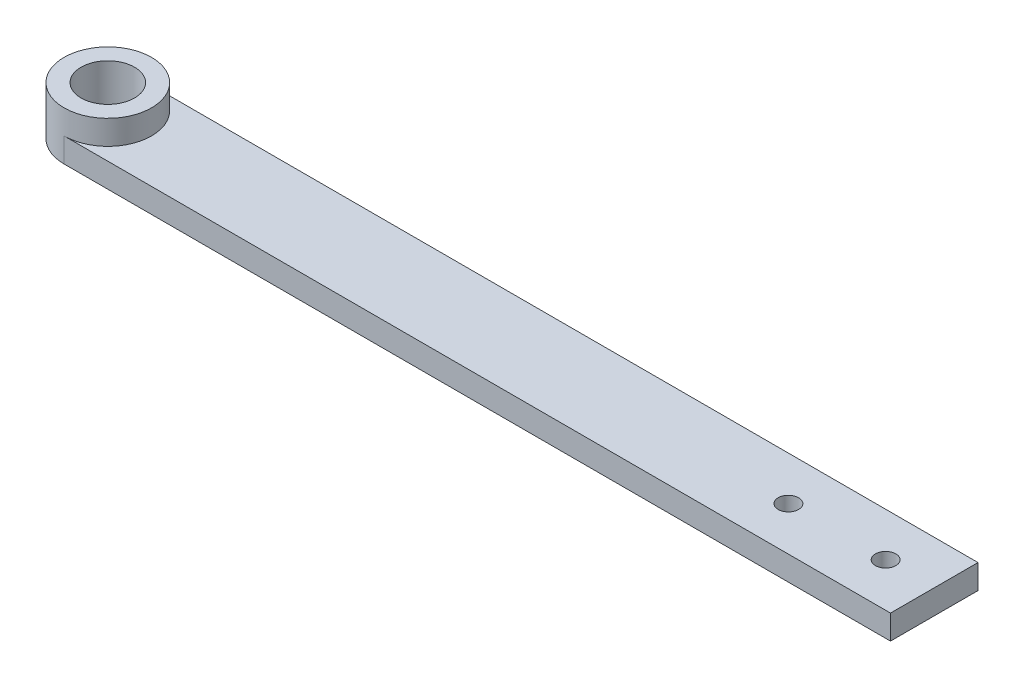
from build123d import *

# Parameters (mm, degrees)
BOSS_EXTRUDE1_DEPTH = 5
SKETCH2_R           = 9
BOSS_EXTRUDE2_DEPTH = 5
SKETCH3_R           = 5.5
CUT_EXTRUDE1_DEPTH  = 181.18046509
SKETCH4_R           = 2.1
CUT_EXTRUDE2_DEPTH  = 180.972220079


with BuildPart() as part:
    # Sketch1 → Boss-Extrude1 (new body)
    with BuildSketch(Plane(origin=(0, 0, 0), x_dir=(1, 0, 0), z_dir=(0, 1, 0))):
        with BuildLine():
            Line((0, 0), (-170, 0))
            ThreePointArc((-170, 0), (-179, -9), (-170, -18))
            Line((-170, -18), (0, -18))
            Line((0, -18), (0, 0))
        make_face()
    extrude(amount=BOSS_EXTRUDE1_DEPTH)

    # Sketch2 → Boss-Extrude2 (add)
    with BuildSketch(Plane(origin=(0, 5, 0), x_dir=(1, 0, 0), z_dir=(0, 1, 0))):
        with Locations(Location((-170, -9, 0), (0, 0, 270))):
            Circle(SKETCH2_R)
    extrude(amount=BOSS_EXTRUDE2_DEPTH)

    # Sketch3 → Cut-Extrude1 (cut, through all)
    with BuildSketch(Plane(origin=(0, 10, 0), x_dir=(1, 0, 0), z_dir=(0, 1, 0))):
        with Locations(Location((-170, -9, 0), (0, 0, 270))):
            Circle(SKETCH3_R)
    extrude(amount=-CUT_EXTRUDE1_DEPTH, mode=Mode.SUBTRACT)

    # Sketch4 → Cut-Extrude2 (cut, through all)
    with BuildSketch(Plane(origin=(0, 5, 0), x_dir=(1, 0, 0), z_dir=(0, 1, 0))):
        with Locations(Location((-10, -9, 0), (0, 0, 270))):
            Circle(SKETCH4_R)
        with Locations(Location((-30, -9, 0), (0, 0, 270))):
            Circle(SKETCH4_R)
    extrude(amount=-CUT_EXTRUDE2_DEPTH, mode=Mode.SUBTRACT)


solid = part.part
